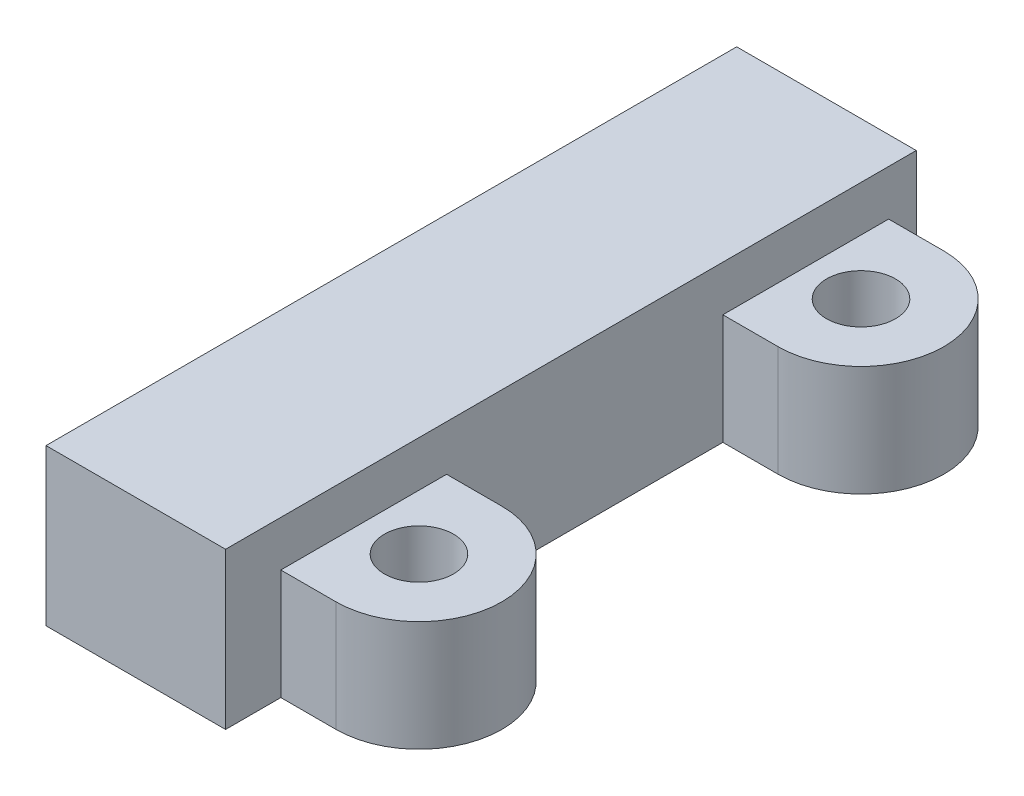
from build123d import *

# Parameters (mm, degrees)
CROQUIS4_W                = 13
CROQUIS4_H                = 11.3
SALIENTE_EXTRUIR1_DEPTH   = 161
CROQUIS5_W                = 151
CROQUIS5_H                = 3.5
CORTAR_EXTRUIR1_DEPTH     = 6.3
SALIENTE_EXTRUIR3_DEPTH   = 8
CROQUIS9_R                = 2.5
CORTAR_EXTRUIR3_DEPTH     = 179.518038304
SIMETR_A8_COPY_1_DEPTH    = 8
SIMETR_A8_COPY_2_SKETCH_R = 2.5
SIMETR_A8_COPY_2_DEPTH    = 179.518038304
CROQUIS10_R               = 2.5
CORTAR_EXTRUIR4_DEPTH     = 179.518038304
MATRIZL1_COUNT            = 3
MATRIZL1_PITCH            = 40.5
CROQUIS11_W               = 61.925542409
CROQUIS11_H               = 21.407853528
CORTAR_EXTRUIR5_DEPTH     = 167.107465215


with BuildPart() as part:
    # Barrer1: sweep along a path in Croquis3
    with BuildLine(Plane(origin=(0, 0, 0), x_dir=(1, 0, 0), z_dir=(0, 1, 0))) as barrer1_path:
        Line((0, 0), (0, -37))
    # Croquis1 → Barrer1 (sweep)
    with BuildSketch(Plane.XY):
        Polygon((0, 0), (0, 11.3), (13, 11.3), (13, 6.3), (5, 6.3), (5, 0), align=None)
    barrer1 = sweep(path=barrer1_path.line)

    # Croquis4 → Saliente-Extruir1 (add)
    with BuildSketch(Plane.ZY):
        with Locations((43.5, 5.65)):
            Rectangle(CROQUIS4_W, CROQUIS4_H)
    extrude(amount=-SALIENTE_EXTRUIR1_DEPTH)

    # Simetría5: Barrer1 across plane
    add(barrer1.mirror(Plane.ZY.offset(-80.5)))

    # Croquis5 → Cortar-Extruir1 (cut)
    with BuildSketch(Plane.XZ):
        with Locations((80.5, 38.75)):
            Rectangle(CROQUIS5_W, CROQUIS5_H)
    extrude(amount=-CORTAR_EXTRUIR1_DEPTH, mode=Mode.SUBTRACT)

    # Croquis8 → Saliente-Extruir3 (add)
    with BuildSketch(Plane.XZ):
        with BuildLine():
            Line((161, 46), (165, 46))
            ThreePointArc((165, 46), (171, 40), (165, 34))
            Line((165, 34), (161, 34))
            Line((161, 34), (161, 46))
        make_face()
    saliente_extruir3 = extrude(amount=-SALIENTE_EXTRUIR3_DEPTH)

    # Croquis9 → Cortar-Extruir3 (cut, through all)
    with BuildSketch(Plane.XZ):
        with Locations((165, 40)):
            Circle(CROQUIS9_R)
    cortar_extruir3 = extrude(amount=-CORTAR_EXTRUIR3_DEPTH, mode=Mode.SUBTRACT)

    # Simetría7: Saliente-Extruir3, Cortar-Extruir3 across plane
    add(saliente_extruir3.mirror(Plane(origin=(0, 0, 24), x_dir=(1, 0, 0), z_dir=(0, 0, -1))))
    add(cortar_extruir3.mirror(Plane(origin=(0, 0, 24), x_dir=(1, 0, 0), z_dir=(0, 0, -1))), mode=Mode.SUBTRACT)

    # Simetría8: Saliente-Extruir3, Cortar-Extruir3 across plane
    add(saliente_extruir3.mirror(Plane.ZY.offset(-80.5)))
    add(cortar_extruir3.mirror(Plane.ZY.offset(-80.5)), mode=Mode.SUBTRACT)

    # Simetría8 copy 1 sketch → Simetría8 copy 1 (add)
    with BuildSketch(Plane(origin=(161, 0, 48), x_dir=(-1, 0, 0), z_dir=(0, -1, 0))):
        with BuildLine():
            Line((161, 46), (165, 46))
            ThreePointArc((165, 46), (171, 40), (165, 34))
            Line((165, 34), (161, 34))
            Line((161, 34), (161, 46))
        make_face()
    extrude(amount=-SIMETR_A8_COPY_1_DEPTH)

    # Simetría8 copy 2 sketch → Simetría8 copy 2 (cut, through all)
    with BuildSketch(Plane(origin=(161, 0, 48), x_dir=(-1, 0, 0), z_dir=(0, -1, 0))):
        with Locations((165, 40)):
            Circle(SIMETR_A8_COPY_2_SKETCH_R)
    extrude(amount=-SIMETR_A8_COPY_2_DEPTH, mode=Mode.SUBTRACT)

    # Croquis10 → Cortar-Extruir4 (cut, through all)
    with BuildSketch(Plane(origin=(0, 11.3, 0), x_dir=(1, 0, 0), z_dir=(0, 1, 0))):
        with Locations(Location((121, -45.25, 0), (0, 0, 270))):
            Circle(CROQUIS10_R)
    cortar_extruir4 = extrude(amount=-CORTAR_EXTRUIR4_DEPTH, mode=Mode.SUBTRACT)

    # MatrizL1: Cortar-Extruir4 ×3
    with Locations(*[(-i * MATRIZL1_PITCH, 0, 0) for i in range(1, MATRIZL1_COUNT)]):
        add(cortar_extruir4, mode=Mode.SUBTRACT)

    # Croquis11 → Cortar-Extruir5 (cut, through all)
    with BuildSketch(Plane.ZY.offset(-148)):
        with Locations((24.861164112, 5.775)):
            Rectangle(CROQUIS11_W, CROQUIS11_H)
    extrude(amount=CORTAR_EXTRUIR5_DEPTH, mode=Mode.SUBTRACT)


solid = part.part
